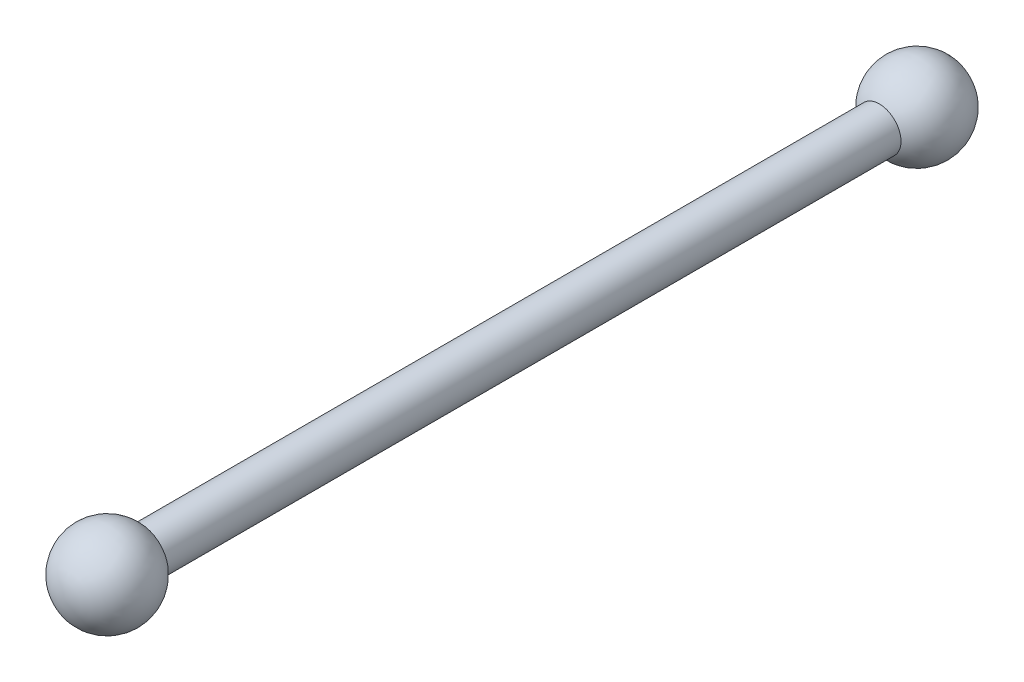
from build123d import *

# Parameters (mm, degrees)
SKETCH1_W = 26
SKETCH1_H = 1.5


with BuildPart() as part:
    # Sketch1 → Revolve1 (revolve)
    with BuildSketch(Plane(origin=(0, 0, 0), x_dir=(0, 0, -1), z_dir=(1, 0, 0))):
        with BuildLine():
            Line((13, 0.75), (13, -0.75))
            Line((13, -0.75), (18, -0.75))
            ThreePointArc((18, -0.75), (15.776457135, 2.147777479), (12.401923789, 0.75))
            Line((12.401923789, 0.75), (13, 0.75))
        make_face()
        Rectangle(SKETCH1_W, SKETCH1_H)
    revolve1 = revolve(axis=Axis((0, -0.75, 13), (0, 0, -1)))

    # Mirror1: Revolve1 across plane
    add(revolve1.mirror(Plane(origin=(0, 0, 13), x_dir=(1, 0, 0), z_dir=(0, 0, -1))))


solid = part.part
